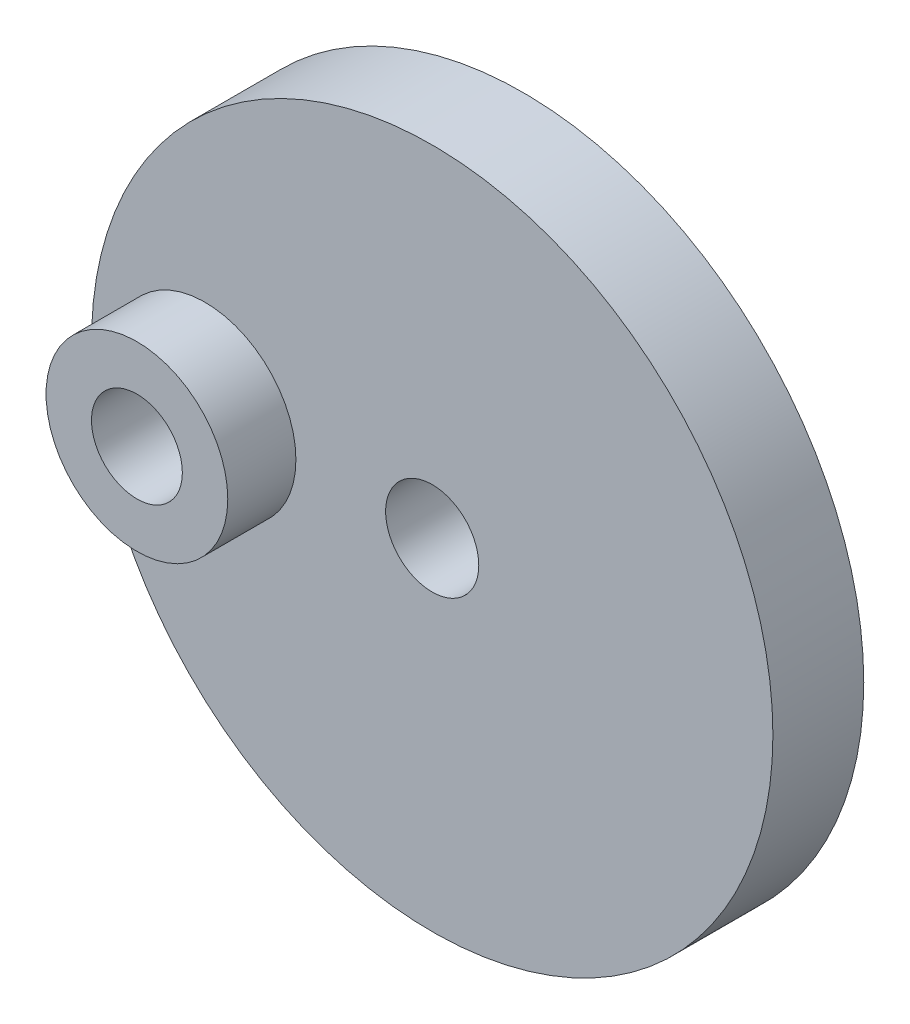
from build123d import *

# Parameters (mm, degrees)
SKETCH_1_R      = 30
SKETCH_1_R_2    = 4.1
SKETCH_1_R_3    = 8
EXTRUDE_3_DEPTH = 8
SKETCH_1_5_R    = 8
SKETCH_1_5_R_2  = 4
EXTRUDE_4_DEPTH = 14


with BuildPart() as part:
    # 草图1 → 凸台-拉伸3 (new body)
    with BuildSketch(Plane.XY):
        Circle(SKETCH_1_R)
        Circle(SKETCH_1_R_2, mode=Mode.SUBTRACT)
        with Locations((-20, 0)):
            Circle(SKETCH_1_R_3, mode=Mode.SUBTRACT)
    extrude(amount=EXTRUDE_3_DEPTH)


with BuildPart() as body_2:
    # 草图1<5> → 凸台-拉伸4 (new body)
    with BuildSketch(Plane.XY):
        with Locations((-20, 0)):
            Circle(SKETCH_1_5_R)
        with Locations((-20, 0)):
            Circle(SKETCH_1_5_R_2, mode=Mode.SUBTRACT)
    extrude(amount=EXTRUDE_4_DEPTH)


solid = Compound([part.part, body_2.part])
